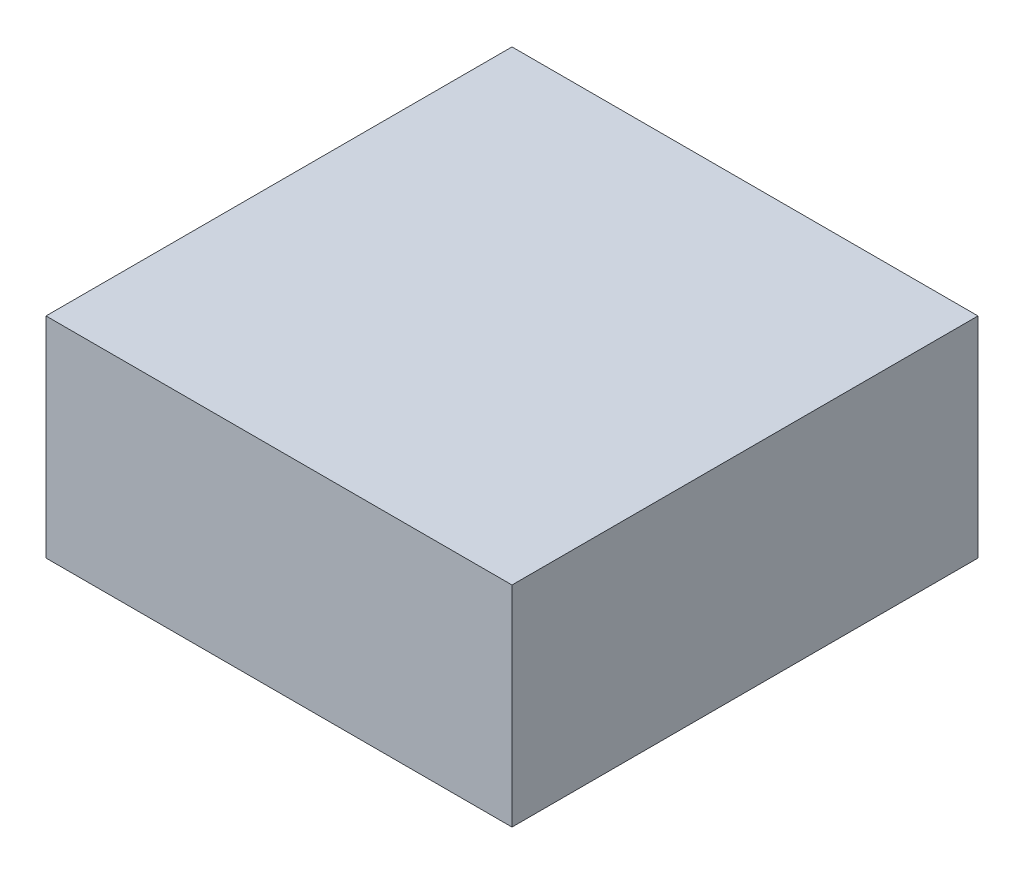
from build123d import *

# Parameters (mm, degrees)
SKETCH1_W           = 20
SKETCH1_H           = 9
BOSS_EXTRUDE1_DEPTH = 20
SKETCH1_10_R        = 2
CUT_EXTRUDE2_DEPTH  = 10
SKETCH2_R           = 2.75
CUT_EXTRUDE1_DEPTH  = 7


with BuildPart() as part:
    # Sketch1 → Boss-Extrude1 (new body)
    with BuildSketch(Plane.XY):
        with Locations((0, -0.5)):
            Rectangle(SKETCH1_W, SKETCH1_H)
    extrude(amount=BOSS_EXTRUDE1_DEPTH)

    # Sketch1<10> → Cut-Extrude2 (cut)
    with BuildSketch(Plane.XY):
        with Locations((-5, 0)):
            Circle(SKETCH1_10_R)
        with Locations((5, 0)):
            Circle(SKETCH1_10_R)
    extrude(amount=CUT_EXTRUDE2_DEPTH, mode=Mode.SUBTRACT)

    # Sketch2 → Cut-Extrude1 (cut)
    with BuildSketch(Plane.XY):
        with Locations((-5, 0)):
            Circle(SKETCH2_R)
        with Locations((5, 0)):
            Circle(SKETCH2_R)
    extrude(amount=CUT_EXTRUDE1_DEPTH, mode=Mode.SUBTRACT)


solid = part.part
